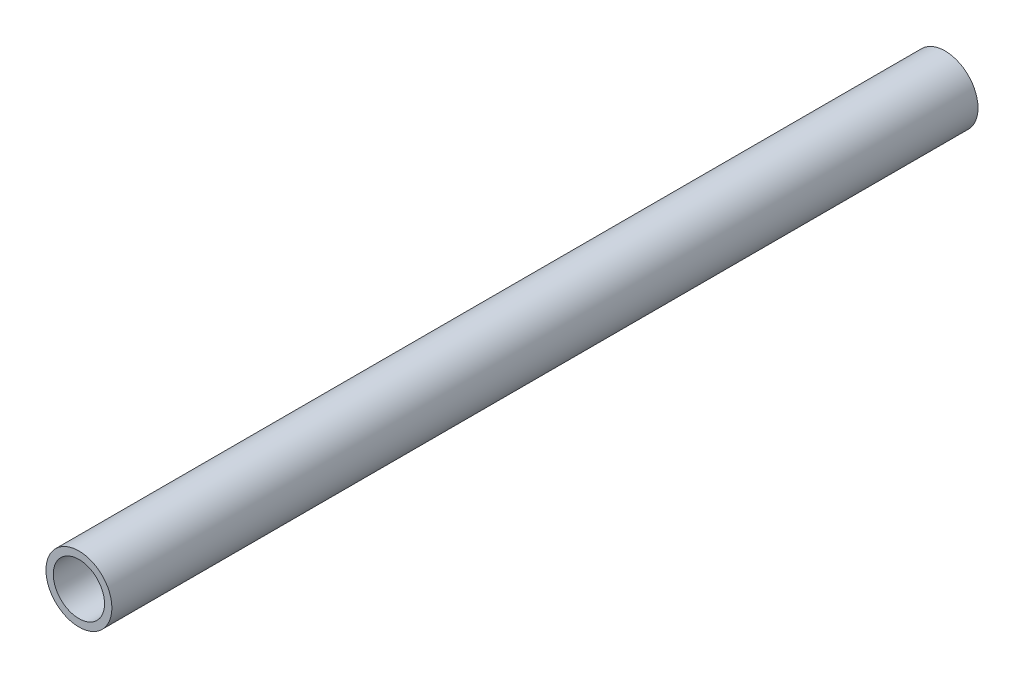
from build123d import *

# Parameters (mm, degrees)
SKETCH_1_R      = 9
SKETCH_1_R_2    = 7
EXTRUDE_1_DEPTH = 236.4


with BuildPart() as part:
    # 草图1 → 凸台-拉伸1 (new body)
    with BuildSketch(Plane.XY):
        Circle(SKETCH_1_R)
        Circle(SKETCH_1_R_2, mode=Mode.SUBTRACT)
    extrude(amount=EXTRUDE_1_DEPTH)


solid = part.part
